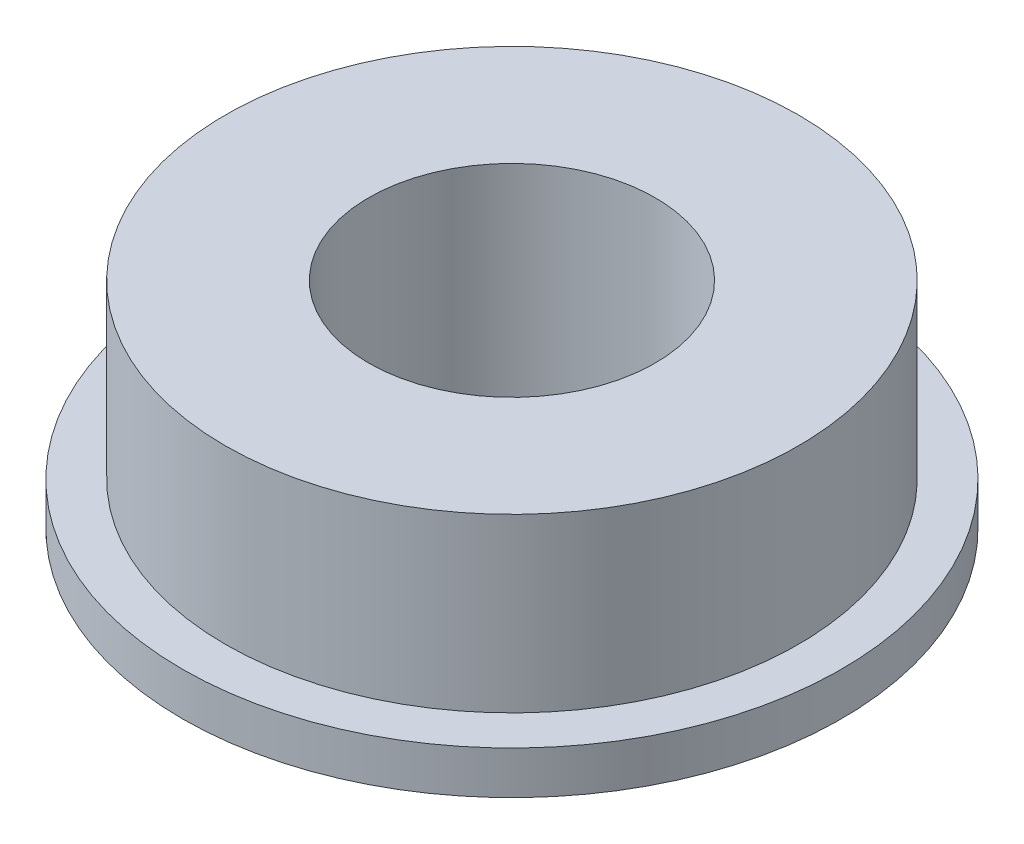
from build123d import *

# Parameters (mm, degrees)
SKETCH_1_R          = 4.6
EXTRUDE_1_DEPTH     = 0.6
SKETCH_3_R          = 4
EXTRUDE_2_DEPTH     = 3
SKETCH_4_R          = 2
CUT_EXTRUDE_1_DEPTH = 8.163797875


with BuildPart() as part:
    # 草圖1 → 填料-伸長1 (new body)
    with BuildSketch(Plane(origin=(0, 0, 0), x_dir=(1, 0, 0), z_dir=(0, 1, 0))):
        with Locations(Location((0, 0, 0), (0, 0, 270))):
            Circle(SKETCH_1_R)
    extrude(amount=EXTRUDE_1_DEPTH)

    # 草圖3 → 填料-伸長2 (add)
    with BuildSketch(Plane(origin=(0, 0, 0), x_dir=(1, 0, 0), z_dir=(0, 1, 0))):
        with Locations(Location((0, 0, 0), (0, 0, 270))):
            Circle(SKETCH_3_R)
    extrude(amount=EXTRUDE_2_DEPTH)

    # 草圖4 → 除料-伸長1 (cut, through all)
    with BuildSketch(Plane(origin=(0, 3, 0), x_dir=(1, 0, 0), z_dir=(0, 1, 0))):
        with Locations(Location((0, 0, 0), (0, 0, 270))):
            Circle(SKETCH_4_R)
    extrude(amount=-CUT_EXTRUDE_1_DEPTH, mode=Mode.SUBTRACT)


solid = part.part
